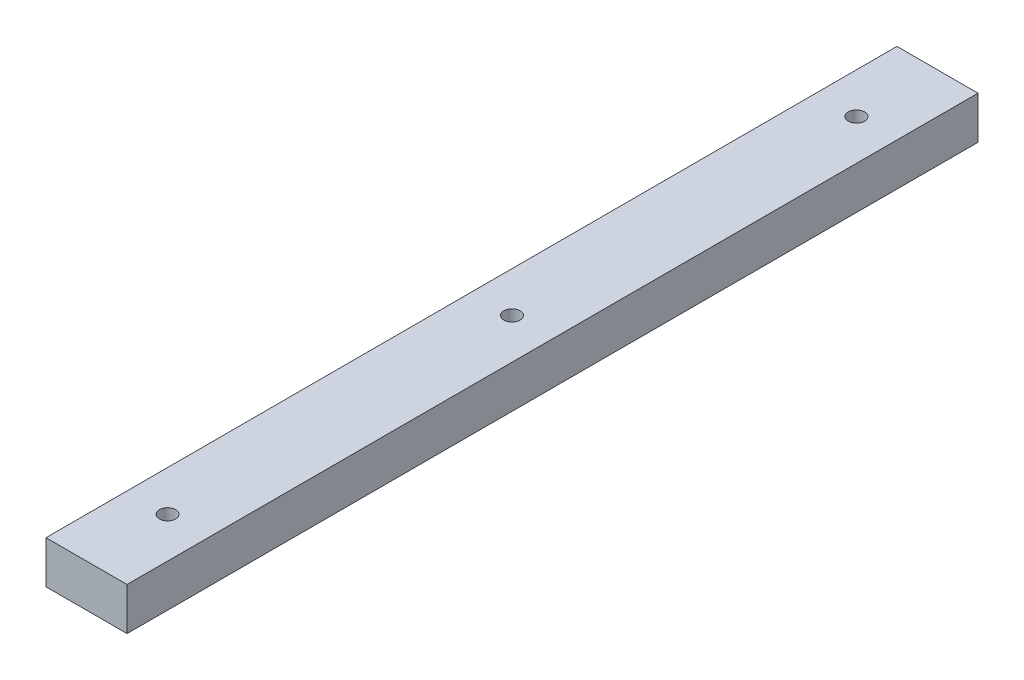
from build123d import *

# Parameters (mm, degrees)
SKETCH1_W           = 20
SKETCH1_H           = 210
SKETCH1_R           = 2
BOSS_EXTRUDE1_DEPTH = 10.5


with BuildPart() as part:
    # Sketch1 → Boss-Extrude1 (new body)
    with BuildSketch(Plane(origin=(0, 0, 0), x_dir=(1, 0, 0), z_dir=(0, 1, 0))):
        Rectangle(SKETCH1_W, SKETCH1_H)
        with Locations(Location((0, 85, 0), (0, 0, 90))):
            Circle(SKETCH1_R, mode=Mode.SUBTRACT)
        with Locations(Location((0, 0, 0), (0, 0, 90))):
            Circle(SKETCH1_R, mode=Mode.SUBTRACT)
        with Locations(Location((0, -85, 0), (0, 0, 90))):
            Circle(SKETCH1_R, mode=Mode.SUBTRACT)
    extrude(amount=BOSS_EXTRUDE1_DEPTH)


solid = part.part
